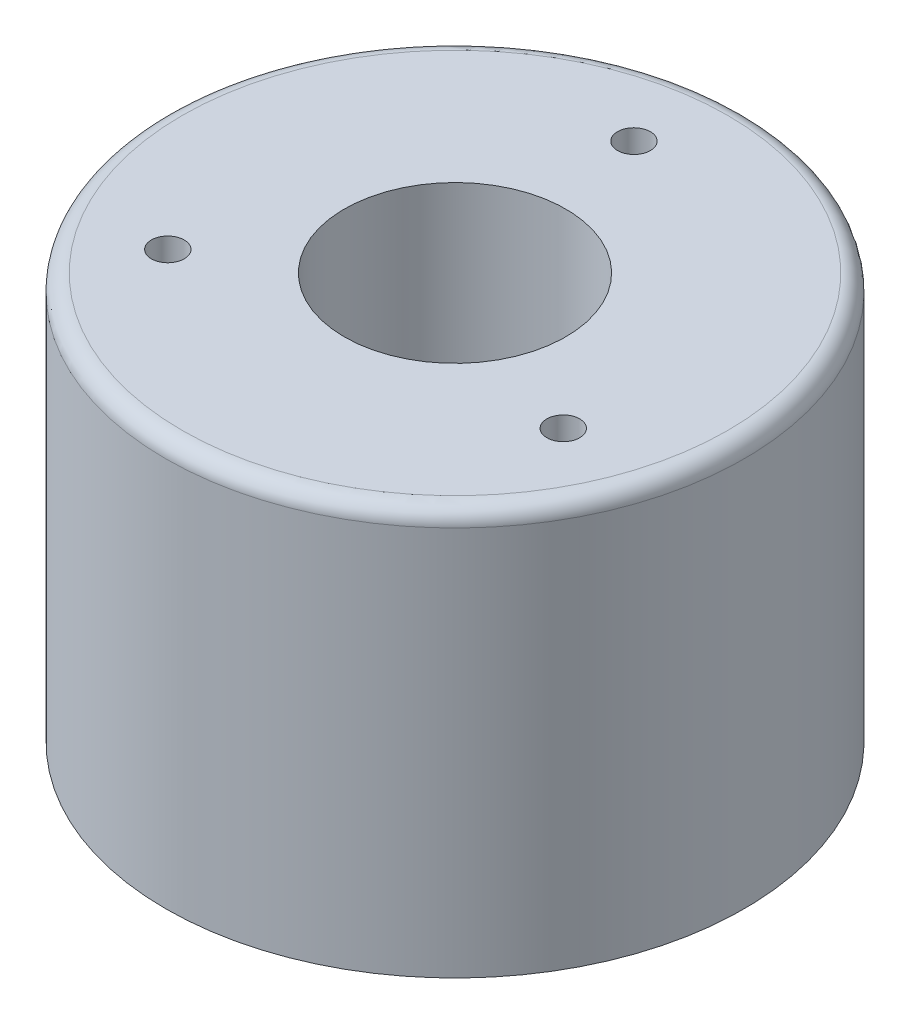
from build123d import *

# Parameters (mm, degrees)
SKETCH1_R           = 35.814
SKETCH1_R_2         = 2.032
BOSS_EXTRUDE1_DEPTH = 50.292
SKETCH2_R           = 13.716
CUT_EXTRUDE1_DEPTH  = 31.75
FILLET1_R           = 2.032


with BuildPart() as part:
    # Sketch1 → Boss-Extrude1 (new body)
    with BuildSketch(Plane(origin=(0, 0, 0), x_dir=(1, 0, 0), z_dir=(0, 1, 0))):
        with Locations(Location((0, 0, 0), (0, 0, 270))):
            Circle(SKETCH1_R)
        with Locations(Location((-20.308177359, -15.255750796, 0), (0, 0, 270))):
            Circle(SKETCH1_R_2, mode=Mode.SUBTRACT)
        with Locations(Location((-3.057779064, 25.215272896, 0), (0, 0, 270))):
            Circle(SKETCH1_R_2, mode=Mode.SUBTRACT)
        with Locations(Location((23.365956423, -9.959522099, 0), (0, 0, 270))):
            Circle(SKETCH1_R_2, mode=Mode.SUBTRACT)
    extrude(amount=BOSS_EXTRUDE1_DEPTH)

    # Sketch2 → Cut-Extrude1 (cut)
    with BuildSketch(Plane(origin=(0, 50.292, 0), x_dir=(1, 0, 0), z_dir=(0, 1, 0))):
        with Locations(Location((0, 0, 0), (0, 0, 270))):
            Circle(SKETCH2_R)
    extrude(amount=-CUT_EXTRUDE1_DEPTH, mode=Mode.SUBTRACT)

    # Fillet1
    fillet1_edges = [part.edges().sort_by_distance(p)[0] for p in [
        (0, 50.292, -35.814),
    ]]
    fillet(fillet1_edges, radius=FILLET1_R)


solid = part.part
